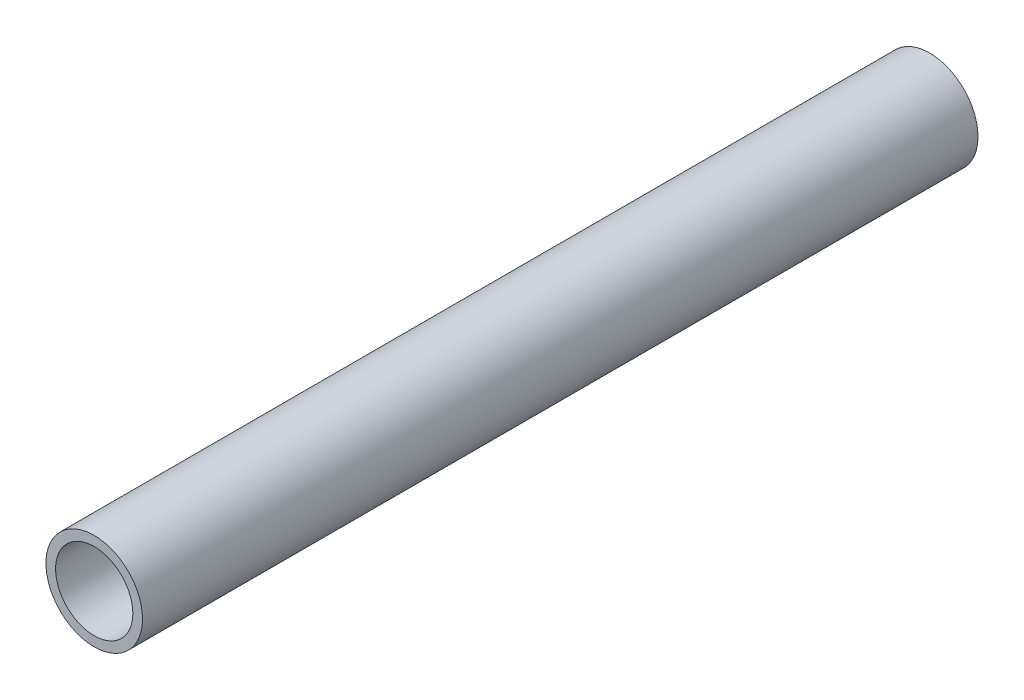
from build123d import *

# Parameters (mm, degrees)
SKETCH_1_R      = 10
SKETCH_1_R_2    = 8
EXTRUDE_1_DEPTH = 173


with BuildPart() as part:
    # 草图1 → 凸台-拉伸1 (new body)
    with BuildSketch(Plane.XY):
        Circle(SKETCH_1_R)
        Circle(SKETCH_1_R_2, mode=Mode.SUBTRACT)
    extrude(amount=EXTRUDE_1_DEPTH)


solid = part.part
